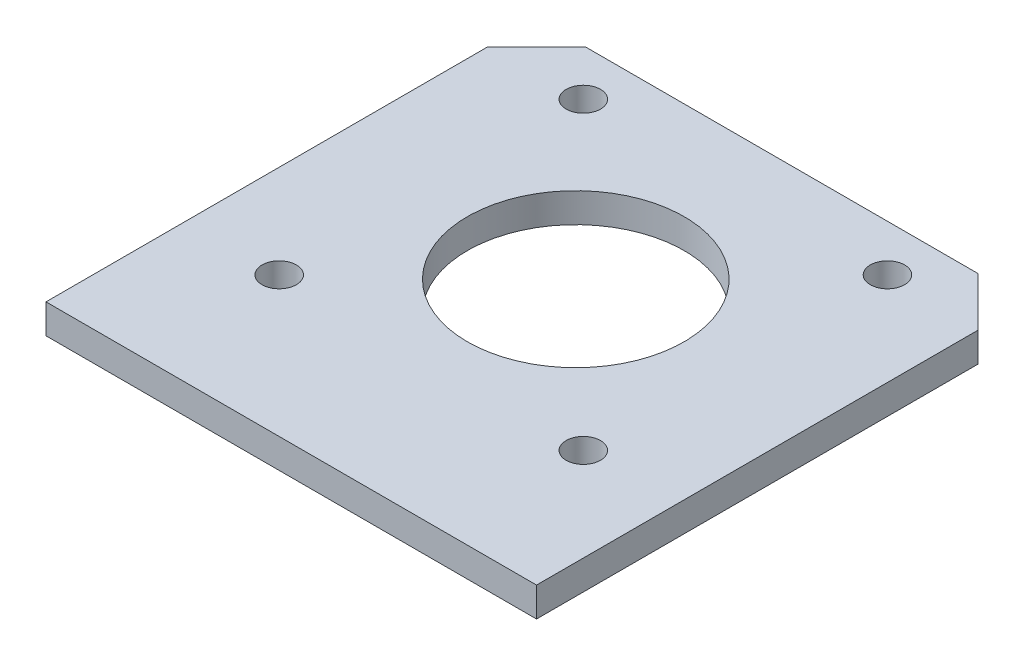
from build123d import *

# Parameters (mm, degrees)
ESBO_O1_R                = 11.05
ESBO_O1_R_2              = 1.75
RESSALTO_EXTRUS_O3_DEPTH = 3


with BuildPart() as part:
    # Esboço1 → Ressalto-extrusão3 (new body)
    with BuildSketch(Plane(origin=(0, 0, 0), x_dir=(1, 0, 0), z_dir=(0, 1, 0))):
        Polygon((-20, 21), (-25, 16), (-25, -29), (25, -29), (25, 16), (20, 21), align=None)
        with Locations(Location((0, 0, 0), (0, 0, 270))):
            Circle(ESBO_O1_R, mode=Mode.SUBTRACT)
        with Locations(Location((-15.5, 16.270899167, 0), (0, 0, 270))):
            Circle(ESBO_O1_R_2, mode=Mode.SUBTRACT)
        with Locations(Location((15.5, 16.270899167, 0), (0, 0, 90))):
            Circle(ESBO_O1_R_2, mode=Mode.SUBTRACT)
        with Locations(Location((-15.5, -14.729100833, 0), (0, 0, 270))):
            Circle(ESBO_O1_R_2, mode=Mode.SUBTRACT)
        with Locations(Location((15.5, -14.729100833, 0), (0, 0, 90))):
            Circle(ESBO_O1_R_2, mode=Mode.SUBTRACT)
    extrude(amount=RESSALTO_EXTRUS_O3_DEPTH)


solid = part.part
